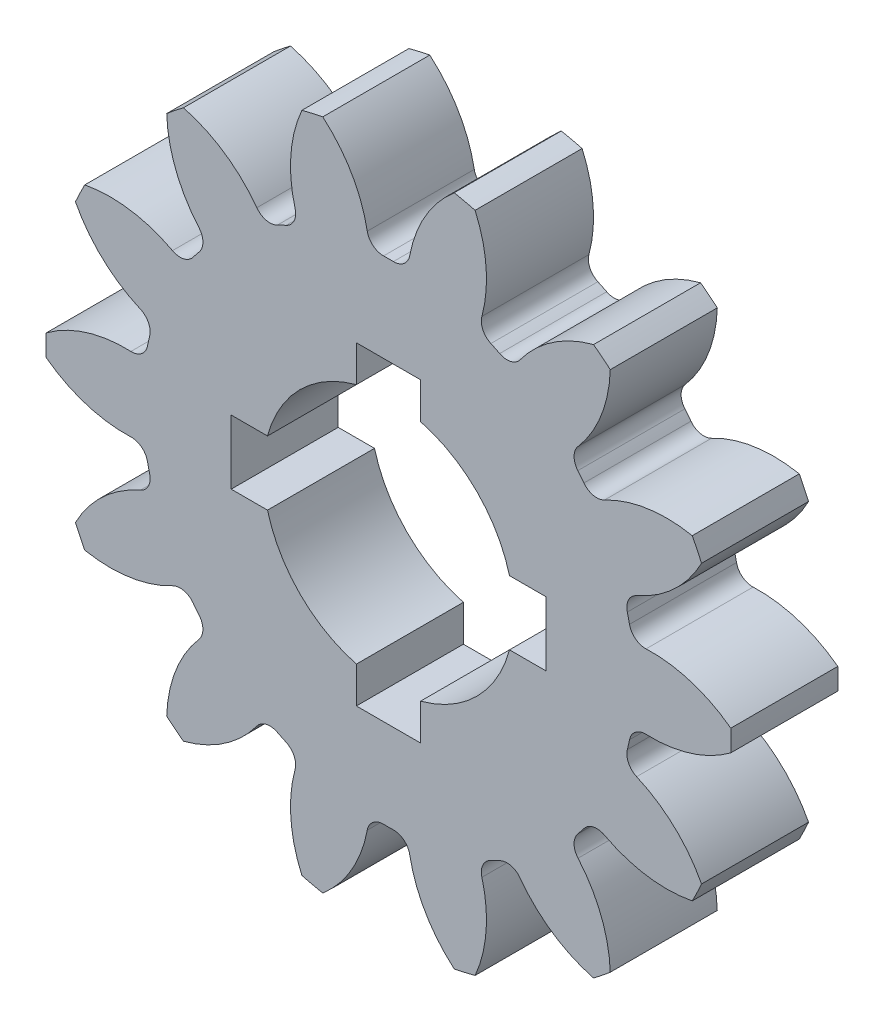
from build123d import *

# Parameters (mm, degrees)
SKETCH1_R                = 16
BOSS_EXTRUDE1_DEPTH      = 5
CUT_EXTRUDE1_DEPTH       = 10
FILLET2_R                = 0.76
CIRPATTERN2_COUNT        = 14
FILLET2_OF_CIRPATTERN2_R = 0.76
CUT_EXTRUDE2_DEPTH       = 5


with BuildPart() as part:
    # Sketch1 → Boss-Extrude1 (new body)
    with BuildSketch(Plane.XY):
        Circle(SKETCH1_R)
    extrude(amount=-BOSS_EXTRUDE1_DEPTH)

    # Sketch1<4> → Cut-Extrude1 (cut)
    with BuildSketch(Plane.XY):
        with BuildLine():
            ThreePointArc((-0.904606154, 11.464365997), (0, 11.5), (0.904606154, 11.464365997))
            ThreePointArc((0.904606154, 11.464365997), (1.565139754, 13.799542352), (3.071192051, 15.702476855))
            ThreePointArc((3.071192051, 15.702476855), (0, 16), (-3.071192051, 15.702476855))
            ThreePointArc((-3.071192051, 15.702476855), (-1.565139754, 13.799542352), (-0.904606154, 11.464365997))
        make_face()
    cut_extrude1 = extrude(amount=-CUT_EXTRUDE1_DEPTH, mode=Mode.SUBTRACT)

    # Fillet2
    fillet2_edges = [part.edges().sort_by_distance(p)[0] for p in [
        (0.904606154, 11.464365997, -2.5),
        (-0.904606154, 11.464365997, -2.5),
    ]]
    fillet(fillet2_edges, radius=FILLET2_R)

    # CirPattern2: Cut-Extrude1 ×14 about axis
    cirpattern2_axis = Axis((0, 0, 0), (0, 0, 1))
    for i in range(1, CIRPATTERN2_COUNT):
        add(cut_extrude1.rotate(cirpattern2_axis, i * 360 / CIRPATTERN2_COUNT), mode=Mode.SUBTRACT)

    # Fillet2 of CirPattern2
    fillet2_of_cirpattern2_edges = [part.edges().sort_by_distance(p)[0] for p in [
        (-4.159180003, 10.721530754, -2.5),
        (-5.789223968, 9.936542953, -2.5),
        (-8.399189551, 7.855164854, -2.5),
        (-9.527214975, 6.440665713, -2.5),
        (-10.975636599, 3.432987218, -2.5),
        (-11.378224212, 1.66913564, -2.5),
        (-11.378224212, -1.66913564, -2.5),
        (-10.975636599, -3.432987218, -2.5),
        (-9.527214975, -6.440665713, -2.5),
        (-8.399189551, -7.855164854, -2.5),
        (-5.789223968, -9.936542953, -2.5),
        (-4.159180003, -10.721530754, -2.5),
        (-0.904606154, -11.464365997, -2.5),
        (0.904606154, -11.464365997, -2.5),
        (4.159180003, -10.721530754, -2.5),
        (5.789223968, -9.936542953, -2.5),
        (8.399189551, -7.855164854, -2.5),
        (9.527214975, -6.440665713, -2.5),
        (10.975636599, -3.432987218, -2.5),
        (11.378224212, -1.66913564, -2.5),
        (11.378224212, 1.66913564, -2.5),
        (10.975636599, 3.432987218, -2.5),
        (9.527214975, 6.440665713, -2.5),
        (8.399189551, 7.855164854, -2.5),
        (5.789223968, 9.936542953, -2.5),
        (4.159180003, 10.721530754, -2.5),
    ]]
    fillet(fillet2_of_cirpattern2_edges, radius=FILLET2_OF_CIRPATTERN2_R)

    # Sketch2 → Cut-Extrude2 (cut)
    with BuildSketch(Plane.XY):
        with BuildLine():
            Line((-1.5, 5.652839314), (-1.5, 7.348469228))
            Line((-1.5, 7.348469228), (1.5, 7.348469228))
            Line((1.5, 7.348469228), (1.5, 5.652839314))
            ThreePointArc((1.5, 5.652839314), (4.135492251, 4.135492251), (5.652839314, 1.5))
            Line((5.652839314, 1.5), (7.348469228, 1.5))
            Line((7.348469228, 1.5), (7.348469228, -1.5))
            Line((7.348469228, -1.5), (5.652839314, -1.5))
            ThreePointArc((5.652839314, -1.5), (4.135492251, -4.135492251), (1.5, -5.652839314))
            Line((1.5, -5.652839314), (1.5, -7.348469228))
            Line((1.5, -7.348469228), (-1.5, -7.348469228))
            Line((-1.5, -7.348469228), (-1.5, -5.652839314))
            ThreePointArc((-1.5, -5.652839314), (-4.135492251, -4.135492251), (-5.652839314, -1.5))
            Line((-5.652839314, -1.5), (-7.348469228, -1.5))
            Line((-7.348469228, -1.5), (-7.348469228, 1.5))
            Line((-7.348469228, 1.5), (-5.652839314, 1.5))
            ThreePointArc((-5.652839314, 1.5), (-4.135492251, 4.135492251), (-1.5, 5.652839314))
        make_face()
    extrude(amount=-CUT_EXTRUDE2_DEPTH, mode=Mode.SUBTRACT)


solid = part.part
